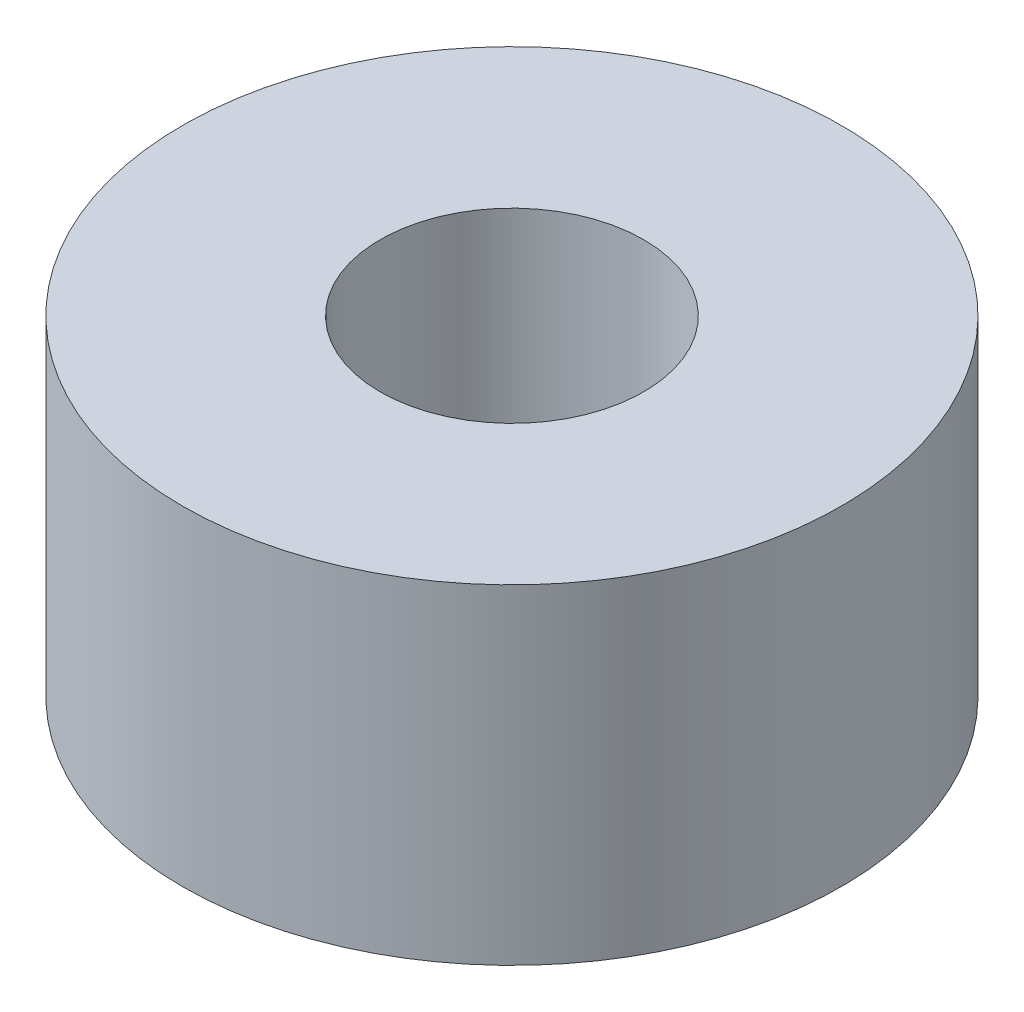
from build123d import *

# Parameters (mm, degrees)
SKETCH_1_R      = 2.5
SKETCH_1_R_2    = 1
EXTRUDE_1_DEPTH = 2.5


with BuildPart() as part:
    # 草图1 → 凸台-拉伸1 (new body)
    with BuildSketch(Plane(origin=(0, 0, 0), x_dir=(1, 0, 0), z_dir=(0, 1, 0))):
        with Locations(Location((0, 0, 0), (0, 0, 270))):
            Circle(SKETCH_1_R)
        with Locations(Location((0, 0, 0), (0, 0, 270))):
            Circle(SKETCH_1_R_2, mode=Mode.SUBTRACT)
    extrude(amount=EXTRUDE_1_DEPTH)


solid = part.part
